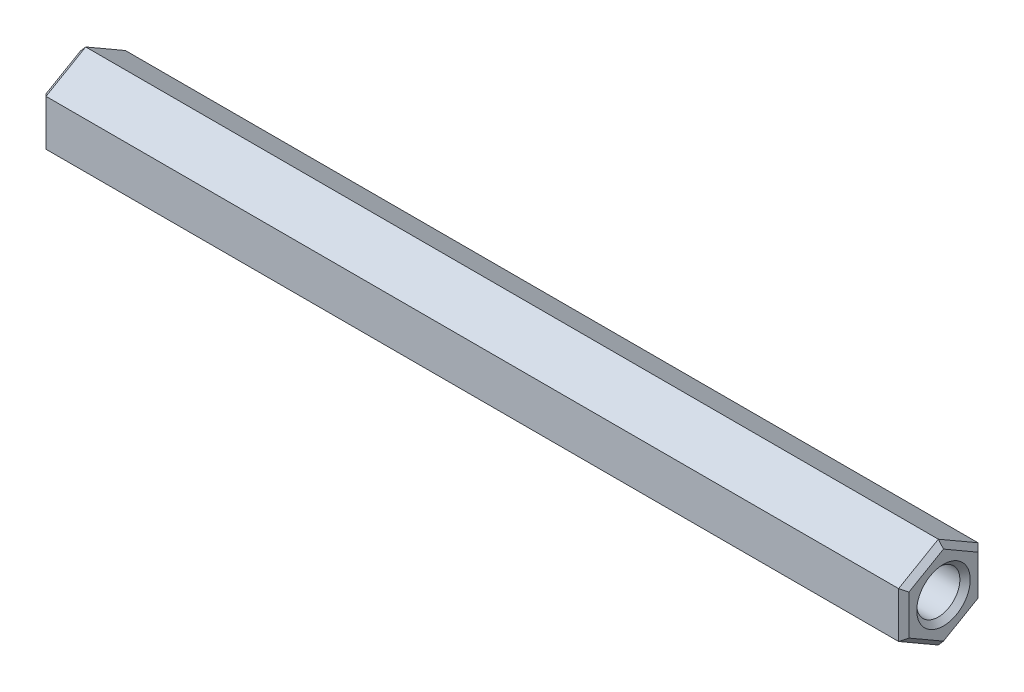
from build123d import *

# Parameters (mm, degrees)
SKETCH_1_R      = 1.25
EXTRUDE_1_DEPTH = 50
CHAMFER_1_SIZE  = 0.3


with BuildPart() as part:
    # 草图1 → 凸台-拉伸1 (new body)
    with BuildSketch(Plane.YZ):
        Polygon((2.655811238, 0), (1.327905619, 2.3), (-1.327905619, 2.3), (-2.655811238, 0), (-1.327905619, -2.3), (1.327905619, -2.3), align=None)
        with Locations(Location((0, 0, 0), (0, 0, 270))):
            Circle(SKETCH_1_R, mode=Mode.SUBTRACT)
    extrude(amount=EXTRUDE_1_DEPTH)

    # 倒角1
    chamfer_1_edges = [part.edges().sort_by_distance(p)[0] for p in [
        (50, 0, 2.3),
        (50, -1.991858429, 1.15),
        (0, 0, 1.25),
        (50, 0, 1.25),
        (50, -1.991858429, -1.15),
        (50, 0, -2.3),
        (50, 1.991858429, -1.15),
        (0, 0, -2.3),
        (0, -1.991858429, -1.15),
        (0, -1.991858429, 1.15),
        (0, 0, 2.3),
        (0, 1.991858429, 1.15),
        (0, 1.991858429, -1.15),
        (50, 1.991858429, 1.15),
    ]]
    chamfer(chamfer_1_edges, length=CHAMFER_1_SIZE)


solid = part.part
